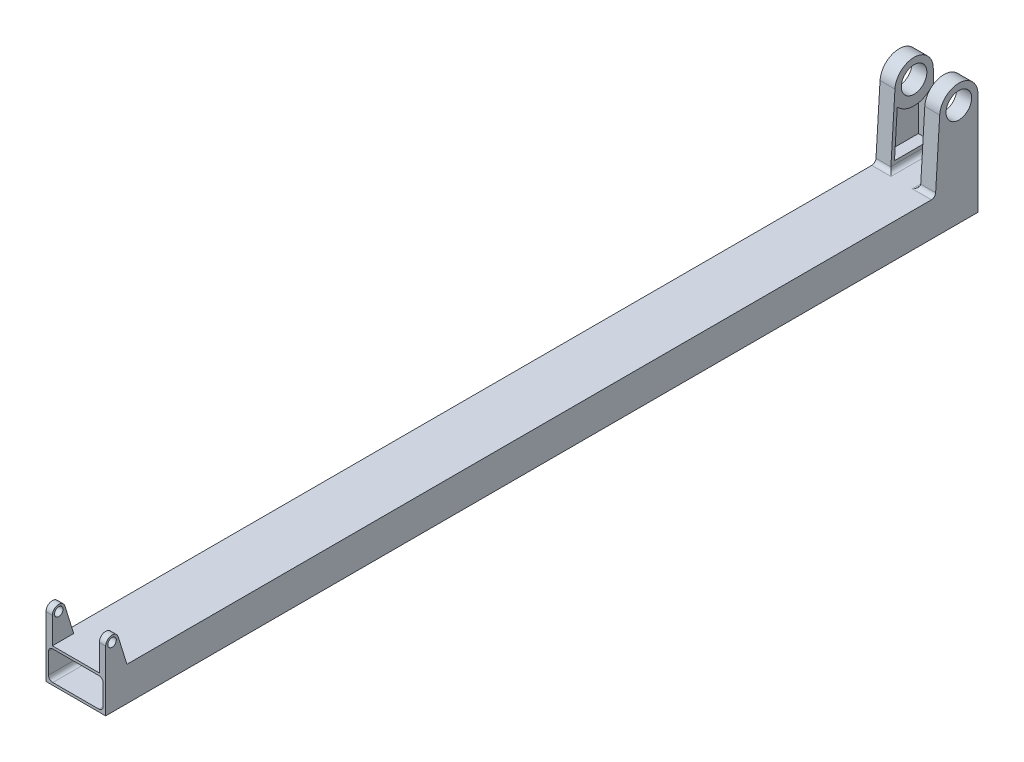
from build123d import *

# Parameters (mm, degrees)
SKETCH2_W               = 177.8
SKETCH2_H               = 101.6
SKETCH2_W_2             = 162.8
SKETCH2_H_2             = 86.6
BOSS_EXTRUDE2_DEPTH     = 2600
SKETCH1_R               = 38.1
BOSS_EXTRUDE3_DEPTH     = 44.45
BOSS_EXTRUDE5_START     = -44.45
SKETCH3_R               = 38.1
BOSS_EXTRUDE5_DEPTH     = 44.45
FILLET1_R               = 12.7
FILLET2_R               = 12.7
SKETCH5_R               = 12.7
BOSS_EXTRUDE7_DEPTH     = 19.05
CUT_EXTRUDE1_DEPTH      = 34.45
CUT_EXTRUDE2_DEPTH      = 2620.044665999
CUT_EXTRUDE2_DEPTH_BACK = 2620.044665999
SKETCH9_W               = 88.9
SKETCH9_H               = 2600


with BuildPart() as part:
    # Sketch2 → Boss-Extrude2 (new body)
    with BuildSketch(Plane.XY):
        with Locations((-88.9, 50.8)):
            Rectangle(SKETCH2_W, SKETCH2_H)
        with Locations((-88.9, 50.8)):
            Rectangle(SKETCH2_W_2, SKETCH2_H_2, mode=Mode.SUBTRACT)
    extrude(amount=BOSS_EXTRUDE2_DEPTH)

    # Sketch1 → Boss-Extrude3 (add)
    with BuildSketch(Plane(origin=(0, 0, 0), x_dir=(0, 0, -1), z_dir=(1, 0, 0))):
        with BuildLine():
            Line((-127, 101.6), (0, 101.6))
            Line((0, 101.6), (0, 304.8))
            ThreePointArc((0, 304.8), (-55.382017361, 361.922646449), (-114.190611982, 308.334272869))
            Line((-114.190611982, 308.334272869), (-127, 101.6))
        make_face()
        with Locations((-57.15, 304.8)):
            Circle(SKETCH1_R, mode=Mode.SUBTRACT)
    extrude(amount=-BOSS_EXTRUDE3_DEPTH)

    # Sketch3 → Boss-Extrude5 (add)
    with BuildSketch(Plane.ZY.offset(177.8).offset(BOSS_EXTRUDE5_START)):
        with BuildLine():
            Line((0, 304.8), (0, 101.6))
            Line((0, 101.6), (127, 101.6))
            Line((127, 101.6), (114.190611982, 308.334272869))
            ThreePointArc((114.190611982, 308.334272869), (55.382017361, 361.922646449), (0, 304.8))
        make_face()
        with Locations(Location((57.15, 304.8, 0), (0, 0, 180))):
            Circle(SKETCH3_R, mode=Mode.SUBTRACT)
    extrude(amount=BOSS_EXTRUDE5_DEPTH)

    # Fillet1
    fillet1_edges = [part.edges().sort_by_distance(p)[0] for p in [
        (-7.5, 94.1, 1300),
        (-170.3, 94.1, 1300),
        (-170.3, 7.5, 1300),
        (-7.5, 7.5, 1300),
    ]]
    fillet(fillet1_edges, radius=FILLET1_R)

    # Fillet2
    fillet2_edges = [part.edges().sort_by_distance(p)[0] for p in [
        (-44.45, 101.6, 63.5),
        (-22.225, 101.6, 127),
        (-133.35, 101.6, 63.5),
        (-155.575, 101.6, 127),
    ]]
    fillet(fillet2_edges, radius=FILLET2_R)

    # Sketch5 → Boss-Extrude7 (add)
    with BuildSketch(Plane(origin=(0, 0, 0), x_dir=(0, 0, -1), z_dir=(1, 0, 0))):
        with BuildLine():
            Line((-2600, 101.6), (-2600, 180.34))
            ThreePointArc((-2600, 180.34), (-2583.812295525, 199.173740052), (-2562.760129729, 185.999604185))
            Line((-2562.760129729, 185.999604185), (-2536.5, 101.6))
            Line((-2536.5, 101.6), (-2600, 101.6))
        make_face()
        with Locations((-2580.95, 180.34)):
            Circle(SKETCH5_R, mode=Mode.SUBTRACT)
    boss_extrude7 = extrude(amount=-BOSS_EXTRUDE7_DEPTH)

    # Mirror1: Boss-Extrude7 across plane
    add(boss_extrude7.mirror(Plane.ZY.offset(88.9)))

    # Sketch8 → Cut-Extrude1 (cut)
    with BuildSketch(Plane(origin=(-133.35, 0, 0), x_dir=(0, 0, -1), z_dir=(1, 0, 0))):
        with BuildLine():
            ThreePointArc((-10, 255.662565187), (-59.256729969, 236.73259452), (-107.248511945, 258.672469165))
            Line((-107.248511945, 258.672469165), (-115.574316238, 124.3))
            Line((-115.574316238, 124.3), (-10, 124.3))
            Line((-10, 124.3), (-10, 255.662565187))
        make_face()
    extrude(amount=-CUT_EXTRUDE1_DEPTH, mode=Mode.SUBTRACT)

    # Sketch9 → Cut-Extrude2 (cut, two sides: drawn at the far end of the back side and taken through both)
    with BuildSketch(Plane(origin=(0, 101.6, 0), x_dir=(1, 0, 0), z_dir=(0, 1, 0)).offset(-CUT_EXTRUDE2_DEPTH_BACK)):
        with Locations((-44.45, -1300)):
            Rectangle(SKETCH9_W, SKETCH9_H)
    extrude(amount=CUT_EXTRUDE2_DEPTH + CUT_EXTRUDE2_DEPTH_BACK, mode=Mode.SUBTRACT)

    # Mirror2: part across plane


with BuildPart() as part_1:
    add(part.part)
    add(part.part.mirror(Plane.ZY.offset(88.9)))


solid = part_1.part
